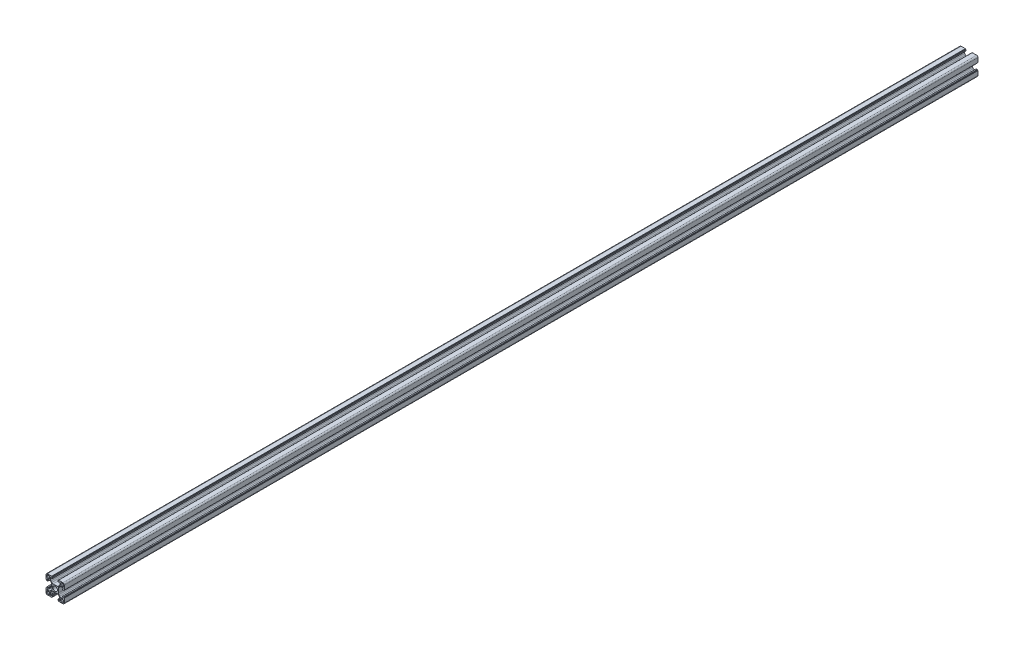
from build123d import *

# Parameters (mm, degrees)
SKETCH_1_R      = 2.5
EXTRUDE_1_DEPTH = 1000


with BuildPart() as part:
    # Эскиз1 → Бобышка-Вытянуть1 (new body)
    with BuildSketch(Plane.XY):
        with BuildLine():
            Line((-8.5, 10), (-3.85, 10))
            ThreePointArc((-3.85, 10), (-3.743933983, 9.956066017), (-3.7, 9.85))
            Line((-3.7, 9.85), (-3.7, 9.549070821))
            Line((-3.7, 9.549070821), (-3.2, 9.549070821))
            ThreePointArc((-3.2, 9.549070821), (-3.093933983, 9.505136838), (-3.05, 9.399070821))
            Line((-3.05, 9.399070821), (-3.05, 8.25))
            ThreePointArc((-3.05, 8.25), (-3.123223305, 8.073223305), (-3.3, 8))
            Line((-3.3, 8), (-3.586446609, 8))
            ThreePointArc((-3.586446609, 8), (-3.682117467, 8.019030117), (-3.763223305, 8.073223305))
            Line((-3.763223305, 8.073223305), (-4.243553391, 8.553553391))
            ThreePointArc((-4.243553391, 8.553553391), (-4.405765065, 8.661939766), (-4.597106781, 8.7))
            Line((-4.597106781, 8.7), (-4.7, 8.7))
            ThreePointArc((-4.7, 8.7), (-5.053553391, 8.553553391), (-5.2, 8.2))
            Line((-5.2, 8.2), (-5.2, 6.452691193))
            ThreePointArc((-5.2, 6.452691193), (-5.047759065, 5.687324329), (-4.614213562, 5.038477631))
            Line((-4.614213562, 5.038477631), (-3.661522369, 4.085786438))
            ThreePointArc((-3.661522369, 4.085786438), (-3.012675671, 3.652240935), (-2.247308807, 3.5))
            Line((-2.247308807, 3.5), (-0.968123556, 3.5))
            Line((-0.968123556, 3.5), (0.968123556, 3.5))
            Line((0.968123556, 3.5), (2.247308807, 3.5))
            ThreePointArc((2.247308807, 3.5), (3.012675671, 3.652240935), (3.661522369, 4.085786438))
            Line((3.661522369, 4.085786438), (4.614213562, 5.038477631))
            ThreePointArc((4.614213562, 5.038477631), (5.047759065, 5.687324329), (5.2, 6.452691193))
            Line((5.2, 6.452691193), (5.2, 8.2))
            ThreePointArc((5.2, 8.2), (5.053553391, 8.553553391), (4.7, 8.7))
            Line((4.7, 8.7), (4.597106781, 8.7))
            ThreePointArc((4.597106781, 8.7), (4.405765065, 8.661939766), (4.243553391, 8.553553391))
            Line((4.243553391, 8.553553391), (3.763223305, 8.073223305))
            ThreePointArc((3.763223305, 8.073223305), (3.682117467, 8.019030117), (3.586446609, 8))
            Line((3.586446609, 8), (3.3, 8))
            ThreePointArc((3.3, 8), (3.123223305, 8.073223305), (3.05, 8.25))
            Line((3.05, 8.25), (3.05, 9.399070821))
            ThreePointArc((3.05, 9.399070821), (3.093933983, 9.505136838), (3.2, 9.549070821))
            Line((3.2, 9.549070821), (3.7, 9.549070821))
            Line((3.7, 9.549070821), (3.7, 9.85))
            ThreePointArc((3.7, 9.85), (3.743933983, 9.956066017), (3.85, 10))
            Line((3.85, 10), (8.5, 10))
            ThreePointArc((8.5, 10), (9.560660172, 9.560660172), (10, 8.5))
            Line((10, 8.5), (10, 3.85))
            ThreePointArc((10, 3.85), (9.956066017, 3.743933983), (9.85, 3.7))
            Line((9.85, 3.7), (9.549070821, 3.7))
            Line((9.549070821, 3.7), (9.549070821, 3.2))
            ThreePointArc((9.549070821, 3.2), (9.505136838, 3.093933983), (9.399070821, 3.05))
            Line((9.399070821, 3.05), (8.25, 3.05))
            ThreePointArc((8.25, 3.05), (8.073223305, 3.123223305), (8, 3.3))
            Line((8, 3.3), (8, 3.586446609))
            ThreePointArc((8, 3.586446609), (8.019030117, 3.682117467), (8.073223305, 3.763223305))
            Line((8.073223305, 3.763223305), (8.553553391, 4.243553391))
            ThreePointArc((8.553553391, 4.243553391), (8.661939766, 4.405765065), (8.7, 4.597106781))
            Line((8.7, 4.597106781), (8.7, 4.7))
            ThreePointArc((8.7, 4.7), (8.553553391, 5.053553391), (8.2, 5.2))
            Line((8.2, 5.2), (6.452691193, 5.2))
            ThreePointArc((6.452691193, 5.2), (5.687324329, 5.047759065), (5.038477631, 4.614213562))
            Line((5.038477631, 4.614213562), (4.085786438, 3.661522369))
            ThreePointArc((4.085786438, 3.661522369), (3.652240935, 3.012675671), (3.5, 2.247308807))
            Line((3.5, 2.247308807), (3.5, 0.968123556))
            Line((3.5, 0.968123556), (3.5, -0.968123556))
            Line((3.5, -0.968123556), (3.5, -2.247308807))
            ThreePointArc((3.5, -2.247308807), (3.652240935, -3.012675671), (4.085786438, -3.661522369))
            Line((4.085786438, -3.661522369), (5.038477631, -4.614213562))
            ThreePointArc((5.038477631, -4.614213562), (5.687324329, -5.047759065), (6.452691193, -5.2))
            Line((6.452691193, -5.2), (8.2, -5.2))
            ThreePointArc((8.2, -5.2), (8.553553391, -5.053553391), (8.7, -4.7))
            Line((8.7, -4.7), (8.7, -4.597106781))
            ThreePointArc((8.7, -4.597106781), (8.661939766, -4.405765065), (8.553553391, -4.243553391))
            Line((8.553553391, -4.243553391), (8.073223305, -3.763223305))
            ThreePointArc((8.073223305, -3.763223305), (8.019030117, -3.682117467), (8, -3.586446609))
            Line((8, -3.586446609), (8, -3.3))
            ThreePointArc((8, -3.3), (8.073223305, -3.123223305), (8.25, -3.05))
            Line((8.25, -3.05), (9.399070821, -3.05))
            ThreePointArc((9.399070821, -3.05), (9.505136838, -3.093933983), (9.549070821, -3.2))
            Line((9.549070821, -3.2), (9.549070821, -3.7))
            Line((9.549070821, -3.7), (9.85, -3.7))
            ThreePointArc((9.85, -3.7), (9.956066017, -3.743933983), (10, -3.85))
            Line((10, -3.85), (10, -8.5))
            ThreePointArc((10, -8.5), (9.560660172, -9.560660172), (8.5, -10))
            Line((8.5, -10), (3.85, -10))
            ThreePointArc((3.85, -10), (3.743933983, -9.956066017), (3.7, -9.85))
            Line((3.7, -9.85), (3.7, -9.549070821))
            Line((3.7, -9.549070821), (3.2, -9.549070821))
            ThreePointArc((3.2, -9.549070821), (3.093933983, -9.505136838), (3.05, -9.399070821))
            Line((3.05, -9.399070821), (3.05, -8.25))
            ThreePointArc((3.05, -8.25), (3.123223305, -8.073223305), (3.3, -8))
            Line((3.3, -8), (3.586446609, -8))
            ThreePointArc((3.586446609, -8), (3.682117467, -8.019030117), (3.763223305, -8.073223305))
            Line((3.763223305, -8.073223305), (4.243553391, -8.553553391))
            ThreePointArc((4.243553391, -8.553553391), (4.405765065, -8.661939766), (4.597106781, -8.7))
            Line((4.597106781, -8.7), (4.7, -8.7))
            ThreePointArc((4.7, -8.7), (5.053553391, -8.553553391), (5.2, -8.2))
            Line((5.2, -8.2), (5.2, -6.452691193))
            ThreePointArc((5.2, -6.452691193), (5.047759065, -5.687324329), (4.614213562, -5.038477631))
            Line((4.614213562, -5.038477631), (3.661522369, -4.085786438))
            ThreePointArc((3.661522369, -4.085786438), (3.012675671, -3.652240935), (2.247308807, -3.5))
            Line((2.247308807, -3.5), (0.968123556, -3.5))
            Line((0.968123556, -3.5), (-0.968123556, -3.5))
            Line((-0.968123556, -3.5), (-2.247308807, -3.5))
            ThreePointArc((-2.247308807, -3.5), (-3.012675671, -3.652240935), (-3.661522369, -4.085786438))
            Line((-3.661522369, -4.085786438), (-4.614213562, -5.038477631))
            ThreePointArc((-4.614213562, -5.038477631), (-5.047759065, -5.687324329), (-5.2, -6.452691193))
            Line((-5.2, -6.452691193), (-5.2, -8.2))
            ThreePointArc((-5.2, -8.2), (-5.053553391, -8.553553391), (-4.7, -8.7))
            Line((-4.7, -8.7), (-4.597106781, -8.7))
            ThreePointArc((-4.597106781, -8.7), (-4.405765065, -8.661939766), (-4.243553391, -8.553553391))
            Line((-4.243553391, -8.553553391), (-3.763223305, -8.073223305))
            ThreePointArc((-3.763223305, -8.073223305), (-3.682117467, -8.019030117), (-3.586446609, -8))
            Line((-3.586446609, -8), (-3.3, -8))
            ThreePointArc((-3.3, -8), (-3.123223305, -8.073223305), (-3.05, -8.25))
            Line((-3.05, -8.25), (-3.05, -9.399070821))
            ThreePointArc((-3.05, -9.399070821), (-3.093933983, -9.505136838), (-3.2, -9.549070821))
            Line((-3.2, -9.549070821), (-3.7, -9.549070821))
            Line((-3.7, -9.549070821), (-3.7, -9.85))
            ThreePointArc((-3.7, -9.85), (-3.743933983, -9.956066017), (-3.85, -10))
            Line((-3.85, -10), (-8.5, -10))
            ThreePointArc((-8.5, -10), (-9.560660172, -9.560660172), (-10, -8.5))
            Line((-10, -8.5), (-10, -3.85))
            ThreePointArc((-10, -3.85), (-9.956066017, -3.743933983), (-9.85, -3.7))
            Line((-9.85, -3.7), (-9.549070821, -3.7))
            Line((-9.549070821, -3.7), (-9.549070821, -3.2))
            ThreePointArc((-9.549070821, -3.2), (-9.505136838, -3.093933983), (-9.399070821, -3.05))
            Line((-9.399070821, -3.05), (-8.25, -3.05))
            ThreePointArc((-8.25, -3.05), (-8.073223305, -3.123223305), (-8, -3.3))
            Line((-8, -3.3), (-8, -3.586446609))
            ThreePointArc((-8, -3.586446609), (-8.019030117, -3.682117467), (-8.073223305, -3.763223305))
            Line((-8.073223305, -3.763223305), (-8.553553391, -4.243553391))
            ThreePointArc((-8.553553391, -4.243553391), (-8.661939766, -4.405765065), (-8.7, -4.597106781))
            Line((-8.7, -4.597106781), (-8.7, -4.7))
            ThreePointArc((-8.7, -4.7), (-8.553553391, -5.053553391), (-8.2, -5.2))
            Line((-8.2, -5.2), (-6.452691193, -5.2))
            ThreePointArc((-6.452691193, -5.2), (-5.687324329, -5.047759065), (-5.038477631, -4.614213562))
            Line((-5.038477631, -4.614213562), (-4.085786438, -3.661522369))
            ThreePointArc((-4.085786438, -3.661522369), (-3.652240935, -3.012675671), (-3.5, -2.247308807))
            Line((-3.5, -2.247308807), (-3.5, -0.968123556))
            Line((-3.5, -0.968123556), (-3.5, 0.968123556))
            Line((-3.5, 0.968123556), (-3.5, 2.247308807))
            ThreePointArc((-3.5, 2.247308807), (-3.652240935, 3.012675671), (-4.085786438, 3.661522369))
            Line((-4.085786438, 3.661522369), (-5.038477631, 4.614213562))
            ThreePointArc((-5.038477631, 4.614213562), (-5.687324329, 5.047759065), (-6.452691193, 5.2))
            Line((-6.452691193, 5.2), (-8.2, 5.2))
            ThreePointArc((-8.2, 5.2), (-8.553553391, 5.053553391), (-8.7, 4.7))
            Line((-8.7, 4.7), (-8.7, 4.597106781))
            ThreePointArc((-8.7, 4.597106781), (-8.661939766, 4.405765065), (-8.553553391, 4.243553391))
            Line((-8.553553391, 4.243553391), (-8.073223305, 3.763223305))
            ThreePointArc((-8.073223305, 3.763223305), (-8.019030117, 3.682117467), (-8, 3.586446609))
            Line((-8, 3.586446609), (-8, 3.3))
            ThreePointArc((-8, 3.3), (-8.073223305, 3.123223305), (-8.25, 3.05))
            Line((-8.25, 3.05), (-9.399070821, 3.05))
            ThreePointArc((-9.399070821, 3.05), (-9.505136838, 3.093933983), (-9.549070821, 3.2))
            Line((-9.549070821, 3.2), (-9.549070821, 3.7))
            Line((-9.549070821, 3.7), (-9.85, 3.7))
            ThreePointArc((-9.85, 3.7), (-9.956066017, 3.743933983), (-10, 3.85))
            Line((-10, 3.85), (-10, 8.5))
            ThreePointArc((-10, 8.5), (-9.560660172, 9.560660172), (-8.5, 10))
        make_face()
        Circle(SKETCH_1_R, mode=Mode.SUBTRACT)
        with BuildLine():
            Line((-8.3, 6.1), (-6.9, 6.1))
            ThreePointArc((-6.9, 6.1), (-6.334314575, 6.334314575), (-6.1, 6.9))
            Line((-6.1, 6.9), (-6.1, 8.3))
            ThreePointArc((-6.1, 8.3), (-6.334314575, 8.865685425), (-6.9, 9.1))
            Line((-6.9, 9.1), (-8.3, 9.1))
            ThreePointArc((-8.3, 9.1), (-8.865685425, 8.865685425), (-9.1, 8.3))
            Line((-9.1, 8.3), (-9.1, 6.9))
            ThreePointArc((-9.1, 6.9), (-8.865685425, 6.334314575), (-8.3, 6.1))
        make_face(mode=Mode.SUBTRACT)
        with BuildLine():
            Line((6.1, 6.9), (6.1, 8.3))
            ThreePointArc((6.1, 8.3), (6.334314575, 8.865685425), (6.9, 9.1))
            Line((6.9, 9.1), (8.3, 9.1))
            ThreePointArc((8.3, 9.1), (8.865685425, 8.865685425), (9.1, 8.3))
            Line((9.1, 8.3), (9.1, 6.9))
            ThreePointArc((9.1, 6.9), (8.865685425, 6.334314575), (8.3, 6.1))
            Line((8.3, 6.1), (6.9, 6.1))
            ThreePointArc((6.9, 6.1), (6.334314575, 6.334314575), (6.1, 6.9))
        make_face(mode=Mode.SUBTRACT)
        with BuildLine():
            Line((8.3, -6.1), (6.9, -6.1))
            ThreePointArc((6.9, -6.1), (6.334314575, -6.334314575), (6.1, -6.9))
            Line((6.1, -6.9), (6.1, -8.3))
            ThreePointArc((6.1, -8.3), (6.334314575, -8.865685425), (6.9, -9.1))
            Line((6.9, -9.1), (8.3, -9.1))
            ThreePointArc((8.3, -9.1), (8.865685425, -8.865685425), (9.1, -8.3))
            Line((9.1, -8.3), (9.1, -6.9))
            ThreePointArc((9.1, -6.9), (8.865685425, -6.334314575), (8.3, -6.1))
        make_face(mode=Mode.SUBTRACT)
        with BuildLine():
            Line((-6.1, -6.9), (-6.1, -8.3))
            ThreePointArc((-6.1, -8.3), (-6.334314575, -8.865685425), (-6.9, -9.1))
            Line((-6.9, -9.1), (-8.3, -9.1))
            ThreePointArc((-8.3, -9.1), (-8.865685425, -8.865685425), (-9.1, -8.3))
            Line((-9.1, -8.3), (-9.1, -6.9))
            ThreePointArc((-9.1, -6.9), (-8.865685425, -6.334314575), (-8.3, -6.1))
            Line((-8.3, -6.1), (-6.9, -6.1))
            ThreePointArc((-6.9, -6.1), (-6.334314575, -6.334314575), (-6.1, -6.9))
        make_face(mode=Mode.SUBTRACT)
    extrude(amount=EXTRUDE_1_DEPTH)


solid = part.part
